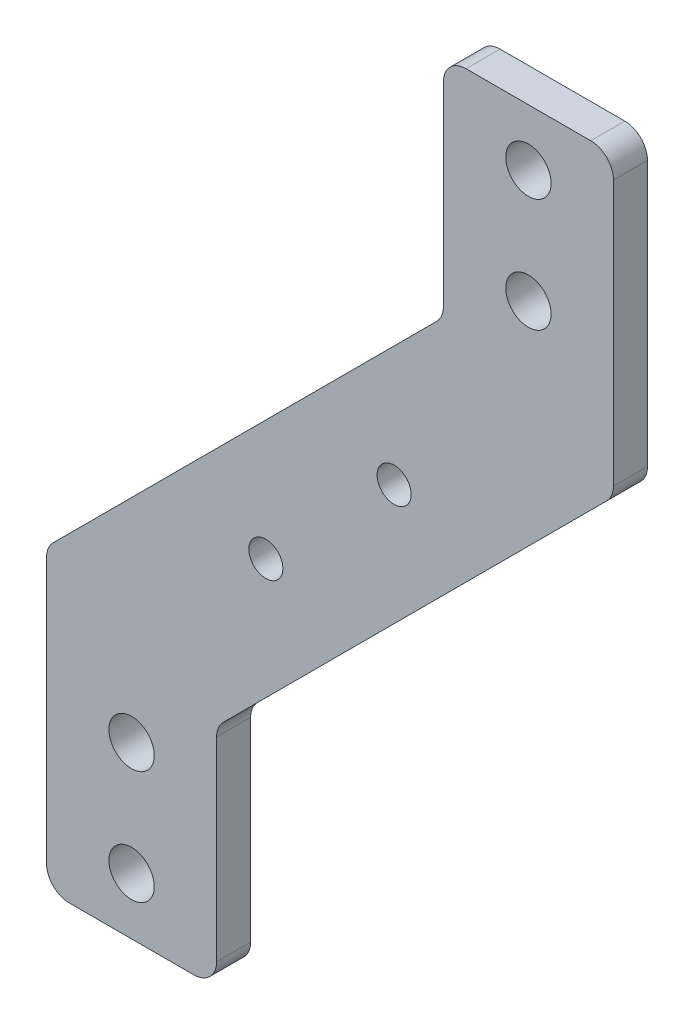
from build123d import *

# Parameters (mm, degrees)
SKETCH_1_R          = 2
EXTRUDE_1_DEPTH     = 3
FILLET_1_R          = 2
SKETCH_2_R          = 1.5
CUT_EXTRUDE_1_DEPTH = 89.484938901


with BuildPart() as part:
    # 草图1 → 凸台-拉伸1 (new body)
    with BuildSketch(Plane.XY):
        Polygon((0, 0), (-15, 0), (-15, 26.213203436), (20, 61.213203436), (20, 81.213203436), (35, 81.213203436), (35, 55), (0, 20), align=None)
        with Locations((-7.5, 15)):
            Circle(SKETCH_1_R, mode=Mode.SUBTRACT)
        with Locations((-7.5, 5)):
            Circle(SKETCH_1_R, mode=Mode.SUBTRACT)
        with Locations((27.5, 76.213203436)):
            Circle(SKETCH_1_R, mode=Mode.SUBTRACT)
        with Locations((27.5, 66.213203436)):
            Circle(SKETCH_1_R, mode=Mode.SUBTRACT)
    extrude(amount=EXTRUDE_1_DEPTH)

    # 圆角1
    fillet_1_edges = [part.edges().sort_by_distance(p)[0] for p in [
        (0, 0, 1.5),
        (-15, 0, 1.5),
        (-15, 26.213203436, 1.5),
        (20, 61.213203436, 1.5),
        (20, 81.213203436, 1.5),
        (35, 81.213203436, 1.5),
        (35, 55, 1.5),
        (0, 20, 1.5),
    ]]
    fillet(fillet_1_edges, radius=FILLET_1_R)

    # 草图2 → 切除-拉伸1 (cut, through all)
    with BuildSketch(Plane(origin=(0, 0, 0), x_dir=(-1, 0, 0), z_dir=(0, 0, -1))):
        with Locations((-15.656854249, 46.263455967)):
            Circle(SKETCH_2_R)
        with Locations((-4.343145751, 34.949747468)):
            Circle(SKETCH_2_R)
    extrude(amount=-CUT_EXTRUDE_1_DEPTH, mode=Mode.SUBTRACT)


solid = part.part
